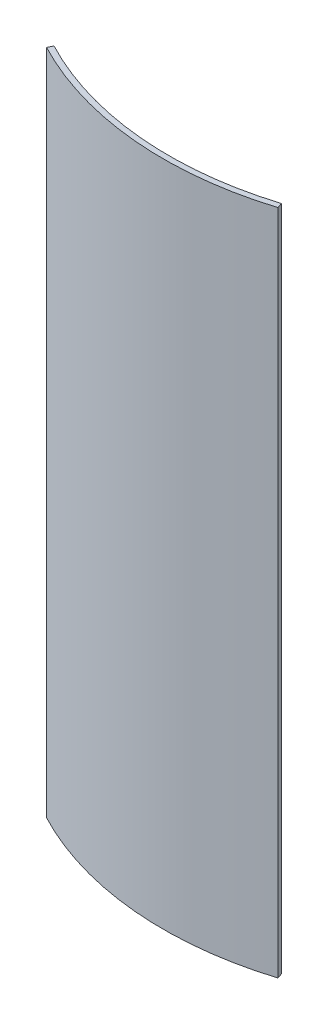
from build123d import *

# Parameters (mm, degrees)
BOSS_EXTRUDE1_DEPTH = 152.4


with BuildPart() as part:
    # Sketch1 → Boss-Extrude1 (new body)
    with BuildSketch(Plane(origin=(0, 0, 0), x_dir=(1, 0, 0), z_dir=(0, 1, 0))):
        with BuildLine():
            Line((-34.811887815, -66.352372729), (-35.386204999, -67.485231687))
            ThreePointArc((-35.386204999, -67.485231687), (-6.867110436, -75.889938689), (22.697439441, -72.741090471))
            Line((22.697439441, -72.741090471), (22.302490765, -71.533934644))
            ThreePointArc((22.302490765, -71.533934644), (-6.770036898, -74.623531814), (-34.811887815, -66.352372729))
        make_face()
    extrude(amount=BOSS_EXTRUDE1_DEPTH)


solid = part.part
